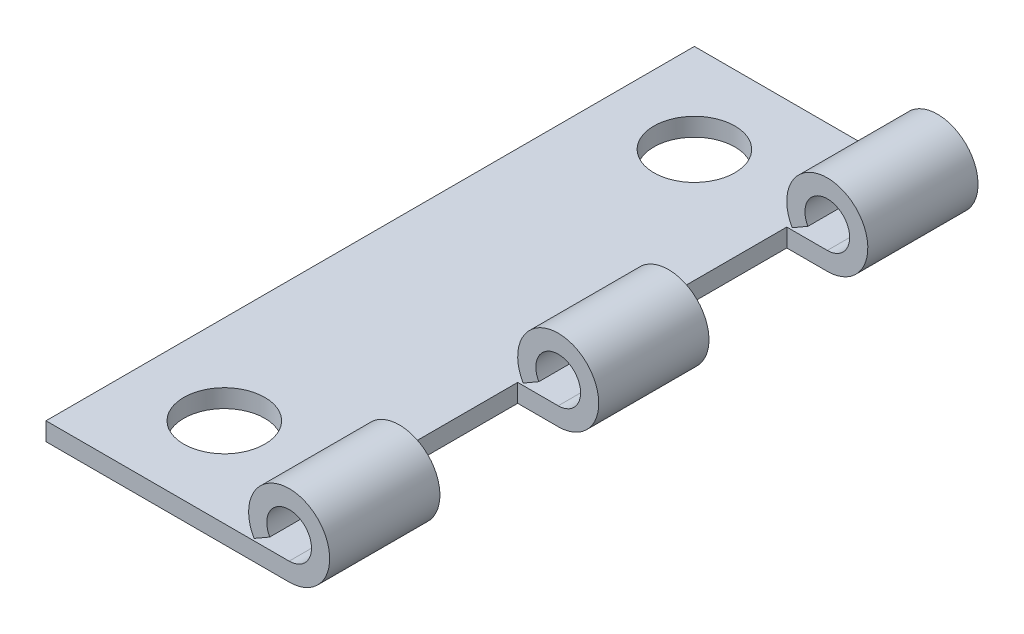
from build123d import *

# Parameters (mm, degrees)
BOSS_EXTRUDE1_DEPTH = 50.8
SKETCH2_W           = 3.175
SKETCH2_H           = 12.446
SKETCH2_R           = 3.175
CUT_EXTRUDE1_DEPTH  = 56.811406764


with BuildPart() as part:
    # Sketch1 → Boss-Extrude1 (new body)
    with BuildSketch(Plane.XY):
        with BuildLine():
            Line((0, 0), (19.05, 0))
            ThreePointArc((19.05, 0), (20.6375, 5.924630657), (16.300369343, 1.5875))
            Line((16.300369343, 1.5875), (17.532203877, 2.2987))
            ThreePointArc((17.532203877, 2.2987), (19.9263, 4.692796123), (19.05, 1.4224))
            Line((19.05, 1.4224), (0, 1.4224))
            Line((0, 1.4224), (0, 0))
        make_face()
    extrude(amount=BOSS_EXTRUDE1_DEPTH)

    # Sketch2 → Cut-Extrude1 (cut, through all)
    with BuildSketch(Plane.XZ):
        with Locations((20.6375, 14.859)):
            Rectangle(SKETCH2_W, SKETCH2_H)
        with Locations((17.4625, 14.859)):
            Rectangle(SKETCH2_W, SKETCH2_H)
        with Locations((20.6375, 35.941)):
            Rectangle(SKETCH2_W, SKETCH2_H)
        with Locations((17.4625, 35.941)):
            Rectangle(SKETCH2_W, SKETCH2_H)
        with Locations(Location((6.985, 43.815, 0), (0, 0, 270))):
            Circle(SKETCH2_R)
        with Locations(Location((6.985, 6.985, 0), (0, 0, 270))):
            Circle(SKETCH2_R)
    extrude(amount=-CUT_EXTRUDE1_DEPTH, mode=Mode.SUBTRACT)


solid = part.part
